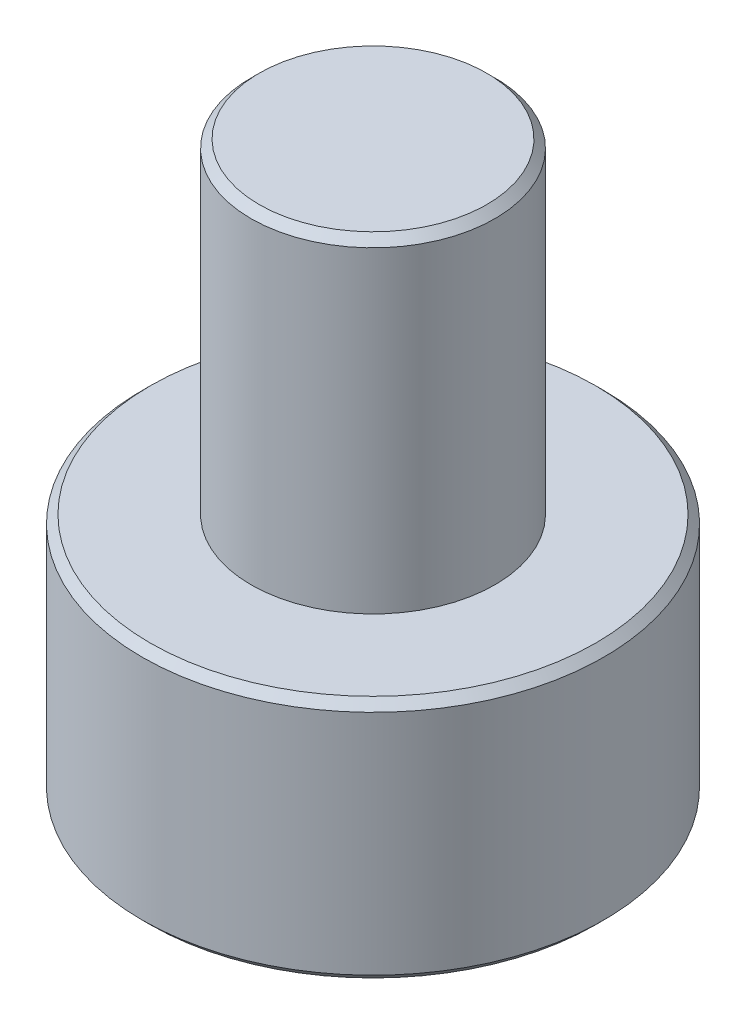
from build123d import *

# Parameters (mm, degrees)
SKETCH_1_R            = 2.84
EXTRUDE_261_DEPTH     = 3
SKETCH_2_R            = 1.5
EXTRUDE_345_DEPTH     = 4
CUT_EXTRUDE_529_DEPTH = 1.3
CHAMFER_591_SIZE      = 0.1


with BuildPart() as part:
    # 草图1 → Extrude 261 (new body)
    with BuildSketch(Plane(origin=(0, 0, 0), x_dir=(1, 0, 0), z_dir=(0, 1, 0))):
        with Locations(Location((0, 0, 0), (0, 0, 270))):
            Circle(SKETCH_1_R)
    extrude(amount=EXTRUDE_261_DEPTH)

    # 草图2 → Extrude 345 (add)
    with BuildSketch(Plane(origin=(0, 3, 0), x_dir=(1, 0, 0), z_dir=(0, 1, 0))):
        with Locations(Location((0, 0, 0), (0, 0, 270))):
            Circle(SKETCH_2_R)
    extrude(amount=EXTRUDE_345_DEPTH)

    # 草图3 → Cut-Extrude 529 (cut)
    with BuildSketch(Plane.XZ):
        Polygon((1.29, -0.744781847), (1.29, 0.744781847), (0, 1.489563695), (-1.29, 0.744781847), (-1.29, -0.744781847), (0, -1.489563695), align=None)
    extrude(amount=-CUT_EXTRUDE_529_DEPTH, mode=Mode.SUBTRACT)

    # Chamfer 591
    chamfer_591_edges = [part.edges().sort_by_distance(p)[0] for p in [
        (0, 0, -2.84),
        (0, 3, -2.84),
        (0, 7, -1.5),
    ]]
    chamfer(chamfer_591_edges, length=CHAMFER_591_SIZE)


solid = part.part
